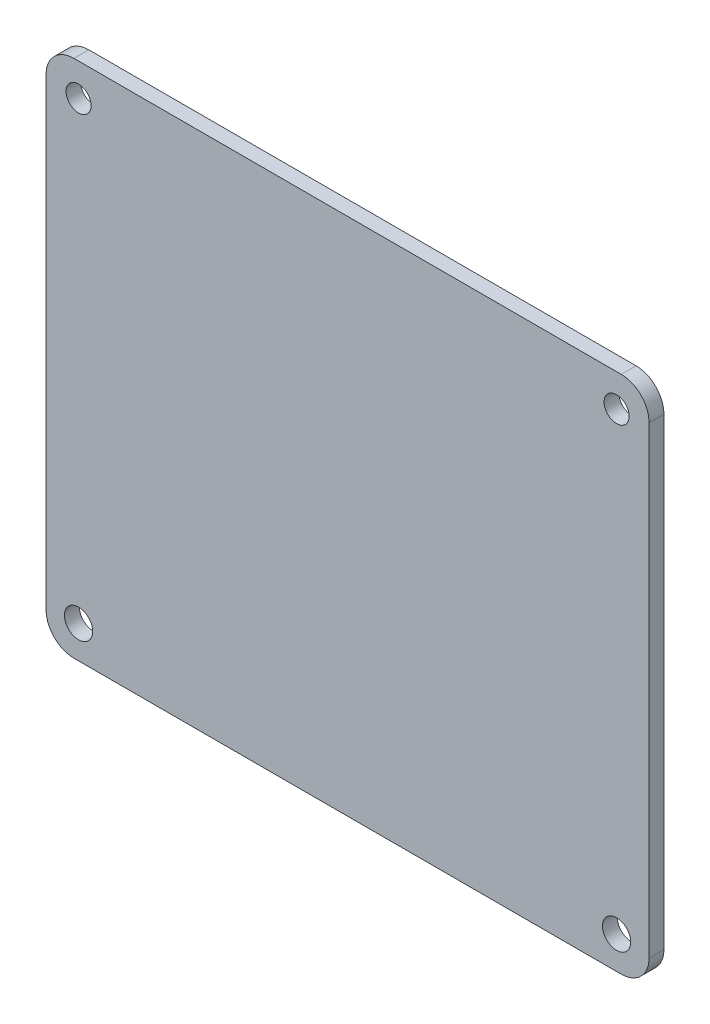
from build123d import *

# Parameters (mm, degrees)
SKETCH1_R           = 1.35
SKETCH1_R_2         = 1.524
BOSS_EXTRUDE1_DEPTH = 1.6


with BuildPart() as part:
    # Sketch1 → Boss-Extrude1 (new body)
    with BuildSketch(Plane.XY):
        with BuildLine():
            Line((22.5, 25), (22.5, -25))
            ThreePointArc((22.5, -25), (21.621320344, -27.121320344), (19.5, -28))
            Line((19.5, -28), (-39.5, -28))
            ThreePointArc((-39.5, -28), (-41.621320344, -27.121320344), (-42.5, -25))
            Line((-42.5, -25), (-42.5, 25))
            ThreePointArc((-42.5, 25), (-41.621320344, 27.121320344), (-39.5, 28))
            Line((-39.5, 28), (19.5, 28))
            ThreePointArc((19.5, 28), (21.621320344, 27.121320344), (22.5, 25))
        make_face()
        with Locations((-39, 24.5)):
            Circle(SKETCH1_R, mode=Mode.SUBTRACT)
        with Locations((-39, -24.5)):
            Circle(SKETCH1_R_2, mode=Mode.SUBTRACT)
        with Locations((19, -24.5)):
            Circle(SKETCH1_R_2, mode=Mode.SUBTRACT)
        with Locations((19, 24.5)):
            Circle(SKETCH1_R, mode=Mode.SUBTRACT)
    extrude(amount=BOSS_EXTRUDE1_DEPTH)


solid = part.part
